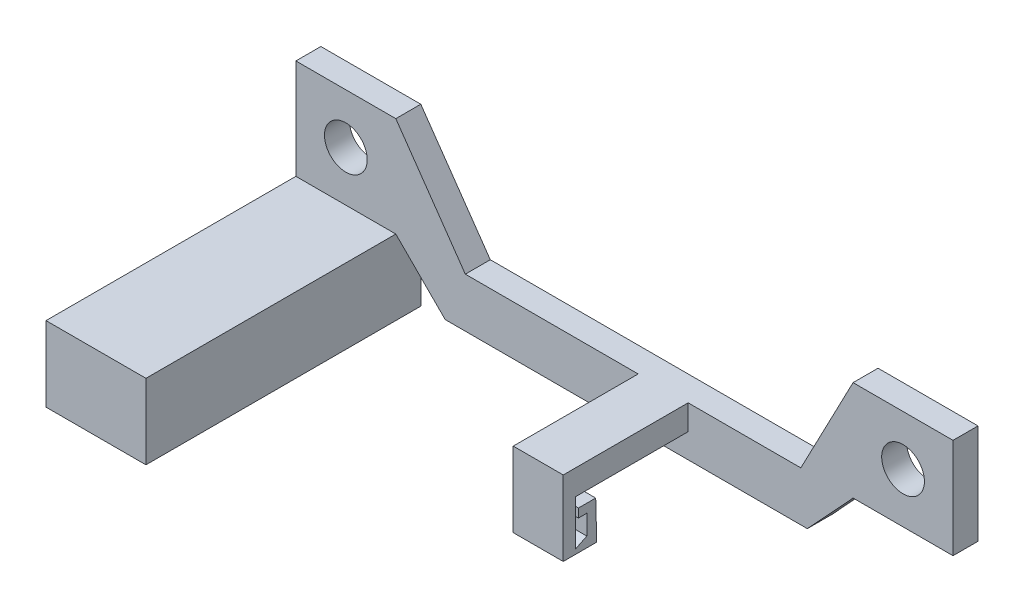
from build123d import *

# Parameters (mm, degrees)
SKETCH1_R                = 2.1717
BOSS_EXTRUDE2_DEPTH      = 2.54
BOSS_EXTRUDE3_DEPTH      = 25.4
BOSS_EXTRUDE3_DEPTH_BACK = 2.54
SKETCH2_W                = 10.16
SKETCH2_H                = 7.62
SKETCH3_W                = 5.08
SKETCH3_H                = 2.54
BOSS_EXTRUDE7_DEPTH      = 12.7
BOSS_EXTRUDE8_DEPTH      = 5.08


with BuildPart() as part:
    # Sketch1 → Boss-Extrude2 (new body)
    with BuildSketch(Plane.XY):
        Polygon((10.102114399, -10.102114399), (46.910827705, -10.102114399), (51.562, -5.08), (61.722, -5.08), (61.722, 5.08), (56.642, 5.08), (51.562, 5.08), (46.252389936, -5.08), (12.145313508, -5.08), (5.08, 5.08), (0, 5.08), (-5.08, 5.08), (-5.08, -5.08), (5.08, -5.08), align=None)
        with Locations((56.642, 0)):
            Circle(SKETCH1_R, mode=Mode.SUBTRACT)
        Circle(SKETCH1_R, mode=Mode.SUBTRACT)
    extrude(amount=BOSS_EXTRUDE2_DEPTH)

    # Sketch2 → Boss-Extrude3 (add, two sides: drawn at the far end of the back side and taken through both)
    with BuildSketch(Plane.XY.offset(2.54).offset(-BOSS_EXTRUDE3_DEPTH_BACK)):
        with Locations((0, -8.89)):
            Rectangle(SKETCH2_W, SKETCH2_H)
    extrude(amount=BOSS_EXTRUDE3_DEPTH + BOSS_EXTRUDE3_DEPTH_BACK)

    # Sketch3 → Boss-Extrude7 (add)
    with BuildSketch(Plane.XY.offset(2.54)):
        with Locations((32.258, -6.35)):
            Rectangle(SKETCH3_W, SKETCH3_H)
    extrude(amount=BOSS_EXTRUDE7_DEPTH)

    # Sketch5 → Boss-Extrude8 (add)
    with BuildSketch(Plane(origin=(34.798, 0, 0), x_dir=(0, 0, -1), z_dir=(1, 0, 0))):
        Polygon((-15.24, -7.62), (-15.24, -12.7), (-13.97, -12.7), (-11.834830977, -12.7), (-11.938, -8.763360945), (-13.693199114, -8.763360945), (-13.693199114, -9.646415213), (-12.841122396, -9.646415213), (-12.841122396, -11.658511366), (-13.97, -12.215842923), (-13.97, -9.646415213), (-13.97, -7.62), align=None)
    extrude(amount=-BOSS_EXTRUDE8_DEPTH)


solid = part.part
